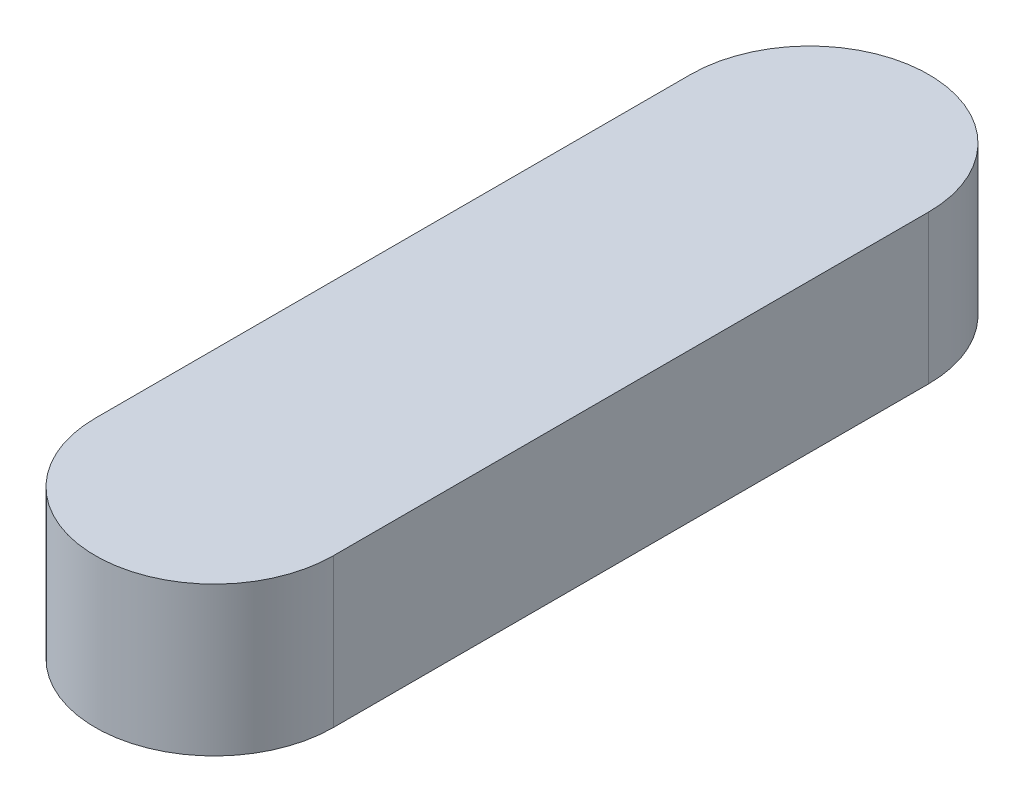
from build123d import *

# Parameters (mm, degrees)
BOSS_EXTRUDE1_START = 5
BOSS_EXTRUDE1_DEPTH = 10


with BuildPart() as part:
    # Sketch4 → Boss-Extrude1 (new body)
    with BuildSketch(Plane(origin=(0, 0, 0), x_dir=(1, 0, 0), z_dir=(0, 1, 0)).offset(BOSS_EXTRUDE1_START)):
        with BuildLine():
            Line((-8, -20), (-8, 20))
            ThreePointArc((-8, 20), (0, 28), (8, 20))
            Line((8, 20), (8, -20))
            ThreePointArc((8, -20), (0, -28), (-8, -20))
        make_face()
    extrude(amount=-BOSS_EXTRUDE1_DEPTH)


solid = part.part
